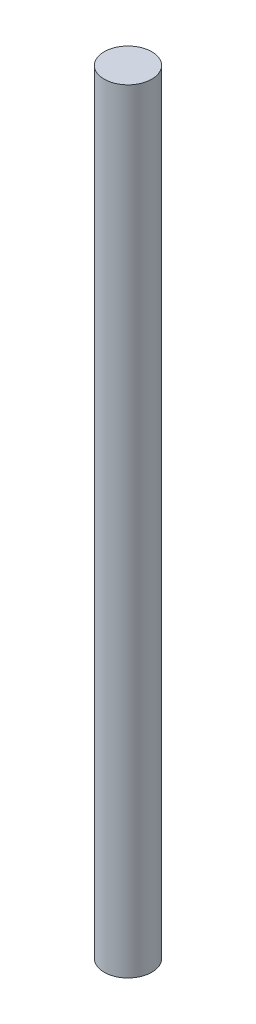
from build123d import *

# Parameters (mm, degrees)
SKETCH1_R           = 4
BOSS_EXTRUDE1_DEPTH = 130


with BuildPart() as part:
    # Sketch1 → Boss-Extrude1 (new body)
    with BuildSketch(Plane(origin=(0, 0, 0), x_dir=(1, 0, 0), z_dir=(0, 1, 0))):
        with Locations(Location((0, 0, 0), (0, 0, 270))):
            Circle(SKETCH1_R)
    extrude(amount=-BOSS_EXTRUDE1_DEPTH)


solid = part.part
